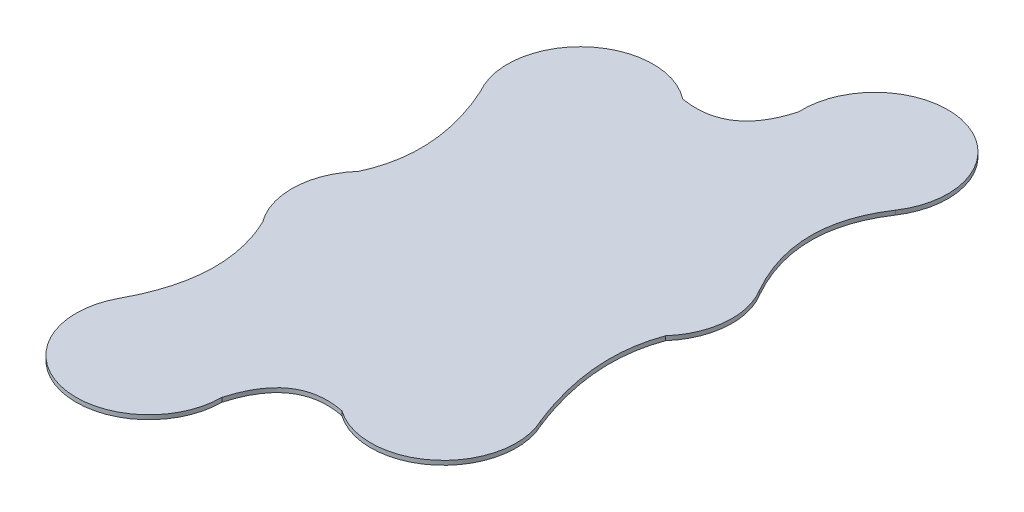
from build123d import *

# Parameters (mm, degrees)
BOSS_EXTRUDE2_DEPTH = 0.5


with BuildPart() as part:
    # Sketch3 → Boss-Extrude2 (new body)
    with BuildSketch(Plane(origin=(0, 0, 0), x_dir=(1, 0, 0), z_dir=(0, 1, 0))):
        with BuildLine():
            ThreePointArc((-36.083785498, -43.43174801), (-46.924843817, -43.7399727), (-48.638393243, -54.449188186))
            add(Edge.make_bspline(
                [(-47.6612581, -69.620420628), (-44.67786304, -63.159473941), (-48.638393243, -54.449188186)],
                knots=[0, 0, 0, 1, 1, 1], degree=2))
            ThreePointArc((-47.6612581, -69.620420628), (-49.809928396, -74.901781564), (-48.13770816, -80.352766508))
            add(Edge.make_bspline(
                [(-48.794359492, -96.384204212), (-44.378776707, -88.222316074), (-48.13770816, -80.352766508)],
                knots=[0, 0, 0, 1, 1, 1], degree=2))
            ThreePointArc((-48.794359492, -96.384204212), (-43.404368002, -108.668799602), (-32.818291991, -100.428757923))
            add(Edge.make_bspline(
                [(-32.818291991, -100.428757923), (-30.846947347, -93.47063926), (-24.445798858, -94.793576843)],
                knots=[0, 0, 0, 1, 1, 1], degree=2))
            ThreePointArc((-24.445798858, -94.793576843), (-14.061121236, -94.354258183), (-11.865583386, -84.19482199))
            add(Edge.make_bspline(
                [(-13.164422653, -68.327872009), (-15.58680525, -74.860973905), (-11.865583386, -84.19482199)],
                knots=[0, 0, 0, 1, 1, 1], degree=2))
            ThreePointArc((-13.164422653, -68.327872009), (-11.067400095, -63.413067651), (-12.317814786, -58.217947961))
            add(Edge.make_bspline(
                [(-12.454215604, -42.252001936), (-17.252491187, -49.486356904), (-12.317814786, -58.217947961)],
                knots=[0, 0, 0, 1, 1, 1], degree=2))
            ThreePointArc((-12.454215604, -42.252001936), (-17.290607023, -29.356176902), (-28.026899399, -37.983170079))
            add(Edge.make_bspline(
                [(-36.083785498, -43.43174801), (-29.83167631, -44.511236738), (-28.026899399, -37.983170079)],
                knots=[0, 0, 0, 1, 1, 1], degree=2))
        make_face()
    extrude(amount=BOSS_EXTRUDE2_DEPTH)


solid = part.part
